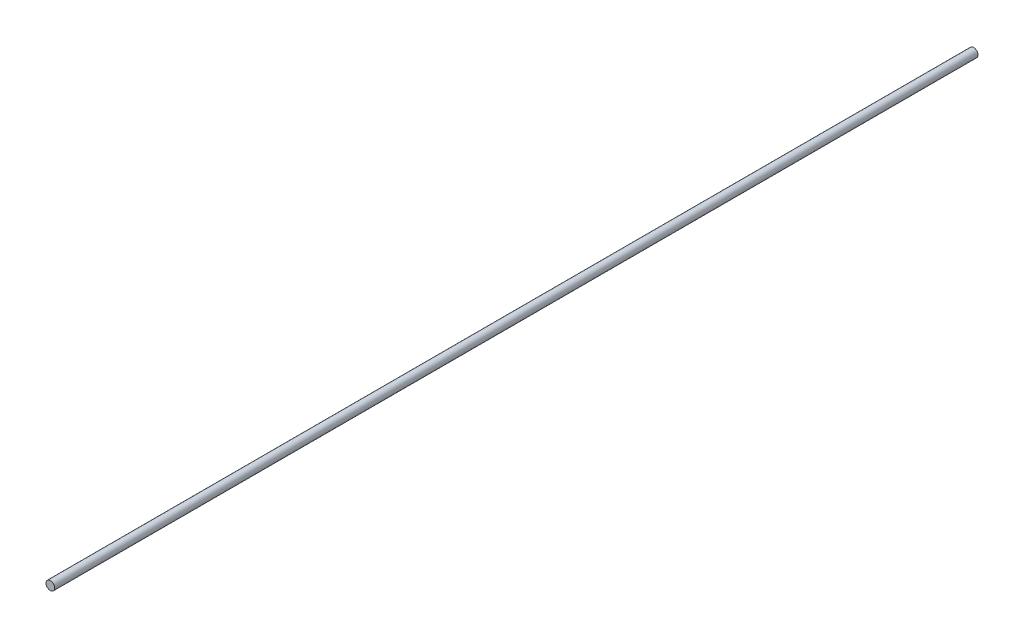
from build123d import *

# Parameters (mm, degrees)
SCHIZZO1_R                   = 1.5
ESTRUSIONE_ESTRUSIONE1_DEPTH = 320


with BuildPart() as part:
    # Schizzo1 → Estrusione-Estrusione1 (new body)
    with BuildSketch(Plane.XY):
        Circle(SCHIZZO1_R)
    extrude(amount=ESTRUSIONE_ESTRUSIONE1_DEPTH)


solid = part.part
